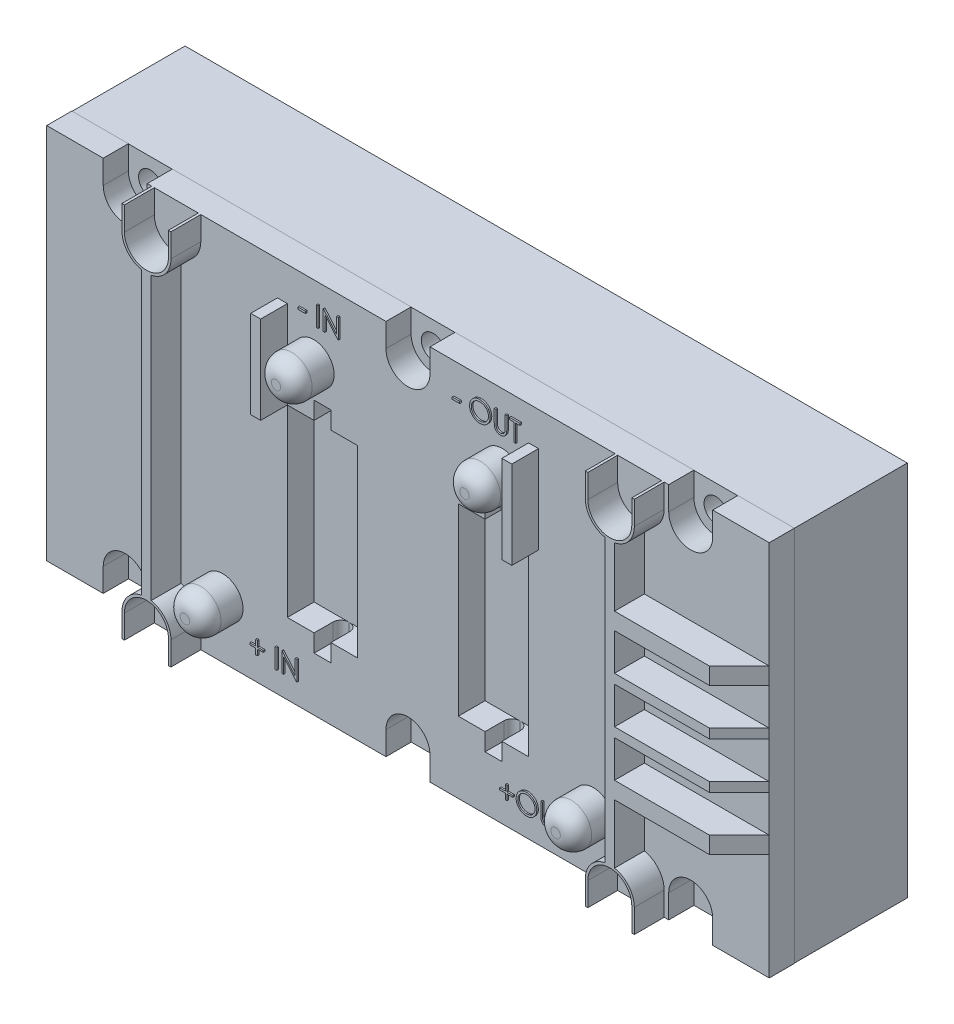
from build123d import *

# Parameters (mm, degrees)
SKETCH1_W            = 116.84
SKETCH1_H            = 60.96
BOSS_EXTRUDE1_DEPTH  = 27.178
CUT_EXTRUDE1_DEPTH   = 72.278120654
LPATTERN1_COUNT      = 3
LPATTERN1_PITCH      = 45.72
MIRROR1_COPY_1_DEPTH = 72.278120654
MIRROR1_COPY_2_DEPTH = 72.278120654
CUT_EXTRUDE2_DEPTH   = 8.89
LPATTERN2_COUNT      = 3
LPATTERN2_PITCH      = 45.72
MIRROR2_COPY_1_DEPTH = 8.89
MIRROR2_COPY_2_DEPTH = 8.89
CUT_EXTRUDE3_DEPTH   = 4.826
SKETCH5_W            = 20.193
SKETCH5_H            = 26.416
BOSS_EXTRUDE2_DEPTH  = 4.826
CHAMFER1_SIZE        = 4.826
SKETCH6_W            = 20.193
SKETCH6_H            = 5.969
CUT_EXTRUDE4_DEPTH   = 4.826
SKETCH7_R            = 3.302
BOSS_EXTRUDE3_DEPTH  = 6.096
FILLET1_R            = 2.54
SKETCH8_W            = 11.357334763
SKETCH8_H            = 29.751279107
CUT_EXTRUDE5_DEPTH   = 4.318
SKETCH9_W            = 1.604840782
SKETCH9_H            = 14.196668453
BOSS_EXTRUDE4_DEPTH  = 4.318
SKETCH10_W           = 2.715884399
SKETCH10_H           = 35.429946488
CUT_EXTRUDE6_DEPTH   = 4.318
FILLET2_R            = 1.27
FILLET2_OF_MIRROR4_R = 1.27
SKETCH11_W           = 1.221153846
SKETCH11_H           = 0.325641025
SKETCH11_W_2         = 0.284935898
SKETCH11_H_2         = 3.175
BOSS_EXTRUDE5_DEPTH  = 0.254
SKETCH12_W           = 1.221153846
SKETCH12_H           = 0.325641026
BOSS_EXTRUDE6_DEPTH  = 0.254
SKETCH13_W           = 0.284935897
SKETCH13_H           = 3.175
BOSS_EXTRUDE7_DEPTH  = 0.254
BOSS_EXTRUDE8_DEPTH  = 0.254
SKETCH15_W           = 116.84
SKETCH15_H           = 60.96
SKETCH15_W_2         = 116.7892
SKETCH15_H_2         = 60.9092
CUT_EXTRUDE7_DEPTH   = 18.288


with BuildPart() as part:
    # Sketch1 → Boss-Extrude1 (new body)
    with BuildSketch(Plane.XY):
        Rectangle(SKETCH1_W, SKETCH1_H)
    extrude(amount=BOSS_EXTRUDE1_DEPTH)

    # Sketch2 → Cut-Extrude1 (cut, through all)
    with BuildSketch(Plane.XY.offset(27.178)):
        with BuildLine():
            ThreePointArc((-47.625, 26.67), (-45.72, 24.765), (-43.815, 26.67))
            ThreePointArc((-43.815, 26.67), (-45.72, 28.575), (-47.625, 26.67))
        make_face()
    cut_extrude1 = extrude(amount=-CUT_EXTRUDE1_DEPTH, mode=Mode.SUBTRACT)

    # LPattern1: Cut-Extrude1 ×3
    with Locations(*[(i * LPATTERN1_PITCH, 0, 0) for i in range(1, LPATTERN1_COUNT)]):
        add(cut_extrude1, mode=Mode.SUBTRACT)

    # Mirror1: Cut-Extrude1 across plane
    add(cut_extrude1.mirror(Plane.ZX), mode=Mode.SUBTRACT)

    # Mirror1 copy 1 sketch → Mirror1 copy 1 (cut, through all)
    with BuildSketch(Plane(origin=(45.72, 0, 27.178), x_dir=(1, 0, 0), z_dir=(0, 0, 1))):
        with BuildLine():
            ThreePointArc((-47.625, -26.67), (-45.72, -24.765), (-43.815, -26.67))
            ThreePointArc((-43.815, -26.67), (-45.72, -28.575), (-47.625, -26.67))
        make_face()
    extrude(amount=-MIRROR1_COPY_1_DEPTH, mode=Mode.SUBTRACT)

    # Mirror1 copy 2 sketch → Mirror1 copy 2 (cut, through all)
    with BuildSketch(Plane(origin=(91.44, 0, 27.178), x_dir=(1, 0, 0), z_dir=(0, 0, 1))):
        with BuildLine():
            ThreePointArc((-47.625, -26.67), (-45.72, -24.765), (-43.815, -26.67))
            ThreePointArc((-43.815, -26.67), (-45.72, -28.575), (-47.625, -26.67))
        make_face()
    extrude(amount=-MIRROR1_COPY_2_DEPTH, mode=Mode.SUBTRACT)

    # Sketch3 → Cut-Extrude2 (cut)
    with BuildSketch(Plane.XY.offset(27.178)):
        with BuildLine():
            Line((-49.276, -26.67), (-49.276, -30.48))
            Line((-49.276, -30.48), (-42.164, -30.48))
            Line((-42.164, -30.48), (-42.164, -26.67))
            ThreePointArc((-42.164, -26.67), (-45.72, -23.114), (-49.276, -26.67))
        make_face()
    cut_extrude2 = extrude(amount=-CUT_EXTRUDE2_DEPTH, mode=Mode.SUBTRACT)

    # LPattern2: Cut-Extrude2 ×3
    with Locations(*[(i * LPATTERN2_PITCH, 0, 0) for i in range(1, LPATTERN2_COUNT)]):
        add(cut_extrude2, mode=Mode.SUBTRACT)

    # Mirror2: Cut-Extrude2 across plane
    add(cut_extrude2.mirror(Plane.ZX), mode=Mode.SUBTRACT)

    # Mirror2 copy 1 sketch → Mirror2 copy 1 (cut)
    with BuildSketch(Plane(origin=(45.72, 0, 27.178), x_dir=(1, 0, 0), z_dir=(0, 0, 1))):
        with BuildLine():
            Line((-49.276, 26.67), (-49.276, 30.48))
            Line((-49.276, 30.48), (-42.164, 30.48))
            Line((-42.164, 30.48), (-42.164, 26.67))
            ThreePointArc((-42.164, 26.67), (-45.72, 23.114), (-49.276, 26.67))
        make_face()
    extrude(amount=-MIRROR2_COPY_1_DEPTH, mode=Mode.SUBTRACT)

    # Mirror2 copy 2 sketch → Mirror2 copy 2 (cut)
    with BuildSketch(Plane(origin=(91.44, 0, 27.178), x_dir=(1, 0, 0), z_dir=(0, 0, 1))):
        with BuildLine():
            Line((-49.276, 26.67), (-49.276, 30.48))
            Line((-49.276, 30.48), (-42.164, 30.48))
            Line((-42.164, 30.48), (-42.164, 26.67))
            ThreePointArc((-42.164, 26.67), (-45.72, 23.114), (-49.276, 26.67))
        make_face()
    extrude(amount=-MIRROR2_COPY_2_DEPTH, mode=Mode.SUBTRACT)

    # Sketch4 → Cut-Extrude3 (cut)
    with BuildSketch(Plane.XY.offset(27.178)):
        with BuildLine():
            Line((-41.429134138, 26.67), (-41.429134138, 30.48))
            Line((-41.429134138, 30.48), (-42.164, 30.48))
            Line((-42.164, 30.48), (-42.164, 26.67))
            ThreePointArc((-42.164, 26.67), (-45.72, 23.114), (-49.276, 26.67))
            Line((-49.276, 26.67), (-49.276, 30.48))
            Line((-49.276, 30.48), (-58.42, 30.48))
            Line((-58.42, 30.48), (-58.42, -30.48))
            Line((-58.42, -30.48), (-49.276, -30.48))
            Line((-49.276, -30.48), (-49.276, -26.67))
            ThreePointArc((-49.276, -26.67), (-45.72, -23.114), (-42.164, -26.67))
            Line((-42.164, -26.67), (-42.164, -30.48))
            Line((-42.164, -30.48), (-41.429134138, -30.48))
            Line((-41.429134138, -30.48), (-41.429134138, -26.67))
            ThreePointArc((-41.429134138, -26.67), (-40.525639613, -24.15070553), (-38.227, -22.779792362))
            Line((-38.227, -22.779792362), (-38.227, 22.779792362))
            ThreePointArc((-38.227, 22.779792362), (-40.525639613, 24.15070553), (-41.429134138, 26.67))
        make_face()
        with BuildLine():
            Line((-3.556, 30.48), (-33.500865862, 30.48))
            Line((-33.500865862, 30.48), (-33.500865862, 26.67))
            ThreePointArc((-33.500865862, 26.67), (-34.404360387, 24.15070553), (-36.703, 22.779792362))
            Line((-36.703, 22.779792362), (-36.703, -22.779792362))
            ThreePointArc((-36.703, -22.779792362), (-34.404360387, -24.15070553), (-33.500865862, -26.67))
            Line((-33.500865862, -26.67), (-33.500865862, -30.48))
            Line((-33.500865862, -30.48), (-3.556, -30.48))
            Line((-3.556, -30.48), (-3.556, -26.67))
            ThreePointArc((-3.556, -26.67), (-2.514471714, -24.155528286), (0, -23.114))
            Line((0, -23.114), (0, 23.114))
            ThreePointArc((0, 23.114), (-2.514471714, 24.155528286), (-3.556, 26.67))
            Line((-3.556, 26.67), (-3.556, 30.48))
        make_face()
        with BuildLine():
            Line((-41.021, -26.67), (-41.021, -30.48))
            Line((-41.021, -30.48), (-33.909, -30.48))
            Line((-33.909, -30.48), (-33.909, -26.67))
            ThreePointArc((-33.909, -26.67), (-37.465, -23.114), (-41.021, -26.67))
        make_face()
        with BuildLine():
            Line((-41.021, 30.48), (-41.021, 26.67))
            ThreePointArc((-41.021, 26.67), (-37.465, 23.114), (-33.909, 26.67))
            Line((-33.909, 26.67), (-33.909, 30.48))
            Line((-33.909, 30.48), (-41.021, 30.48))
        make_face()
    cut_extrude3 = extrude(amount=-CUT_EXTRUDE3_DEPTH, mode=Mode.SUBTRACT)

    # Mirror3: Cut-Extrude3 across plane
    add(cut_extrude3.mirror(Plane(origin=(0, 0, 0), x_dir=(0, 0, 1), z_dir=(1, 0, 0))), mode=Mode.SUBTRACT)

    # Sketch5 → Boss-Extrude2 (add)
    with BuildSketch(Plane.XY.offset(22.352)):
        with Locations((48.3235, 0)):
            Rectangle(SKETCH5_W, SKETCH5_H)
    extrude(amount=BOSS_EXTRUDE2_DEPTH)

    # Chamfer1
    chamfer1_edges = [part.edges().sort_by_distance(p)[0] for p in [
        (58.42, 0, 27.178),
    ]]
    chamfer(chamfer1_edges, length=CHAMFER1_SIZE)

    # Sketch6 → Cut-Extrude4 (cut)
    with BuildSketch(Plane.XY.offset(27.178)):
        with Locations((48.3235, 7.493)):
            Rectangle(SKETCH6_W, SKETCH6_H)
        with Locations((48.3235, 0)):
            Rectangle(SKETCH6_W, SKETCH6_H)
        with Locations((48.3235, -7.493)):
            Rectangle(SKETCH6_W, SKETCH6_H)
    extrude(amount=-CUT_EXTRUDE4_DEPTH, mode=Mode.SUBTRACT)

    # Sketch7 → Boss-Extrude3 (add)
    with BuildSketch(Plane.XY.offset(22.352)):
        with Locations(Location((-15.24, 18.796, 0), (0, 0, 180))):
            Circle(SKETCH7_R)
        with Locations(Location((15.24, 18.796, 0), (0, 0, 180))):
            Circle(SKETCH7_R)
        with Locations(Location((29.972, -21.336, 0), (0, 0, 180))):
            Circle(SKETCH7_R)
        with Locations(Location((-29.972, -21.336, 0), (0, 0, 180))):
            Circle(SKETCH7_R)
    extrude(amount=BOSS_EXTRUDE3_DEPTH)

    # Fillet1
    fillet1_edges = [part.edges().sort_by_distance(p)[0] for p in [
        (-11.938, 18.796, 28.448),
        (18.542, 18.796, 28.448),
        (33.274, -21.336, 28.448),
        (-26.67, -21.336, 28.448),
    ]]
    fillet(fillet1_edges, radius=FILLET1_R)

    # Sketch8 → Cut-Extrude5 (cut)
    with BuildSketch(Plane.XY.offset(22.352)):
        with Locations((-13.826320581, -4.073826599)):
            Rectangle(SKETCH8_W, SKETCH8_H)
    cut_extrude5 = extrude(amount=-CUT_EXTRUDE5_DEPTH, mode=Mode.SUBTRACT)

    # Sketch9 → Boss-Extrude4 (add)
    with BuildSketch(Plane.XY.offset(22.352)):
        with Locations((-20.307408353, 17.90014718)):
            Rectangle(SKETCH9_W, SKETCH9_H)
    boss_extrude4 = extrude(amount=BOSS_EXTRUDE4_DEPTH)

    # Sketch10 → Cut-Extrude6 (cut)
    with BuildSketch(Plane.XY.offset(22.352)):
        with Locations((-13.826320581, -4.0738266)):
            Rectangle(SKETCH10_W, SKETCH10_H)
    cut_extrude6 = extrude(amount=-CUT_EXTRUDE6_DEPTH, mode=Mode.SUBTRACT)

    # Fillet2
    fillet2_edges = [part.edges().sort_by_distance(p)[0] for p in [
        (-15.18426278, 12.221479799, 18.034),
        (-12.468378381, 12.221479799, 18.034),
        (-12.468378381, -20.369132998, 18.034),
        (-15.18426278, -20.369132998, 18.034),
    ]]
    fillet(fillet2_edges, radius=FILLET2_R)

    # Mirror4: Cut-Extrude5, Boss-Extrude4, Cut-Extrude6 across plane
    add(cut_extrude5.mirror(Plane(origin=(0, 0, 0), x_dir=(0, 0, 1), z_dir=(1, 0, 0))), mode=Mode.SUBTRACT)
    add(boss_extrude4.mirror(Plane(origin=(0, 0, 0), x_dir=(0, 0, 1), z_dir=(1, 0, 0))))
    add(cut_extrude6.mirror(Plane(origin=(0, 0, 0), x_dir=(0, 0, 1), z_dir=(1, 0, 0))), mode=Mode.SUBTRACT)

    # Fillet2 of Mirror4
    fillet2_of_mirror4_edges = [part.edges().sort_by_distance(p)[0] for p in [
        (15.18426278, 12.221479799, 18.034),
        (12.468378381, 12.221479799, 18.034),
        (12.468378381, -20.369132998, 18.034),
        (15.18426278, -20.369132998, 18.034),
    ]]
    fillet(fillet2_of_mirror4_edges, radius=FILLET2_OF_MIRROR4_R)

    # Sketch11 → Boss-Extrude5 (add)
    with BuildSketch(Plane.XY.offset(22.352)):
        with Locations((-16.920556291, 25.478939508)):
            Rectangle(SKETCH11_W, SKETCH11_H)
        with Locations((-14.417190906, 25.845285661)):
            Rectangle(SKETCH11_W_2, SKETCH11_H_2)
        Polygon((-13.460620393, 24.257785661), (-13.460620393, 27.432785661), (-13.400834736, 27.432785661), (-11.303248598, 24.9338724), (-11.303248598, 27.432785661), (-11.018312701, 27.432785661), (-11.018312701, 24.257785661), (-11.083186499, 24.257785661), (-13.175684496, 26.750974764), (-13.175684496, 24.257785661), align=None)
    extrude(amount=BOSS_EXTRUDE5_DEPTH)

    # Sketch12 → Boss-Extrude6 (add)
    # profile 1 of 4: a face of its own
    with BuildSketch(Plane.XY.offset(22.352)):
        with Locations((8.016200471, 25.355490217)):
            Rectangle(SKETCH12_W, SKETCH12_H)
    # profile 2 of 4: a face of its own
    with BuildSketch(Plane.XY.offset(22.352)):
        with BuildLine():
            add(Edge.make_bspline(
                [(11.862835086, 27.390746627), (11.921625296, 27.389257571), (12.03709412, 27.386332941), (12.206797777, 27.363945469), (12.368809042, 27.325214651), (12.524447668, 27.273631802), (12.671852011, 27.204821038), (12.812131578, 27.121649511), (12.944952599, 27.023245866), (13.068524852, 26.910370782), (13.181606514, 26.787558649), (13.281234283, 26.656496545), (13.364729792, 26.517976917), (13.433296899, 26.37241602), (13.487089209, 26.22014305), (13.524208627, 26.060346204), (13.547919664, 25.89406085), (13.55069169, 25.780643622), (13.552097907, 25.723108406)],
                knots=[0, 0, 0, 0, 1.065120563, 2.091984664, 3.0946048, 4.079830382, 5.057816894, 6.036188127, 7.030412546, 8.04752943, 9.064399622, 10.05169764, 11.02544977, 11.989514704, 12.962713494, 13.945757189, 14.957906945, 16, 16, 16, 16], degree=3))
            add(Edge.make_bspline(
                [(13.552097907, 25.723108406), (13.550691896, 25.665997008), (13.547920487, 25.553423827), (13.524181668, 25.388193702), (13.486951618, 25.229361428), (13.433796433, 25.077192157), (13.365556178, 24.931525367), (13.281504701, 24.792744344), (13.182498032, 24.660803592), (13.069824674, 24.537148532), (12.946996586, 24.423757969), (12.815251987, 24.324952989), (12.677553761, 24.239931819), (12.532129954, 24.172092343), (12.380909206, 24.117870672), (12.222538099, 24.080902215), (12.057758725, 24.057056112), (11.945390029, 24.054317887), (11.888275791, 24.052926114)],
                knots=[0, 0, 0, 0, 1.043624062, 2.057103931, 3.04512605, 4.022047818, 4.998200453, 5.980619268, 6.982898556, 8.009068085, 9.034988726, 10.034168286, 11.015286542, 11.987931943, 12.962482838, 13.94673481, 14.956375938, 16, 16, 16, 16], degree=3))
            add(Edge.make_bspline(
                [(11.888275791, 24.052926114), (11.830740873, 24.054331629), (11.717324235, 24.057102274), (11.550829924, 24.080852548), (11.390920828, 24.11799216), (11.238054238, 24.171068577), (11.092144909, 24.239664208), (10.952907476, 24.323306751), (10.820900821, 24.422554658), (10.69721938, 24.535191479), (10.584054036, 24.657811387), (10.485393745, 24.789196747), (10.401732392, 24.926769911), (10.333367084, 25.070912665), (10.279242895, 25.220928188), (10.24231781, 25.377817164), (10.21842734, 25.540685145), (10.2156743, 25.651576917), (10.214277394, 25.707843983)],
                knots=[0, 0, 0, 0, 1.053102029, 2.075944431, 3.073151272, 4.055350789, 5.033113405, 6.020478099, 7.024410459, 8.052272461, 9.079885166, 10.07527673, 11.055994387, 12.023226415, 12.992069828, 13.970394897, 14.97016774, 16, 16, 16, 16], degree=3))
            add(Edge.make_bspline(
                [(10.214277394, 25.707843983), (10.214762385, 25.745610761), (10.215726248, 25.820667873), (10.22733014, 25.932125432), (10.244168255, 26.041790529), (10.26829999, 26.149351317), (10.299861002, 26.254544496), (10.337101055, 26.358095545), (10.382585058, 26.458955066), (10.434002503, 26.557600857), (10.49139, 26.652495172), (10.554777287, 26.742193079), (10.621937943, 26.827447269), (10.695564736, 26.90604848), (10.773231082, 26.980283297), (10.856196897, 27.049010904), (10.943955933, 27.112851038), (11.036885806, 27.170382348), (11.13269667, 27.222415277), (11.231463461, 27.267066528), (11.331844779, 27.305389741), (11.434310781, 27.336451061), (11.538589367, 27.360972979), (11.644908129, 27.377671078), (11.753182366, 27.389304567), (11.826126919, 27.390263872), (11.862835086, 27.390746627)],
                knots=[0, 0, 0, 0, 1.037015668, 2.060948919, 3.074880161, 4.083647147, 5.086022904, 6.090072063, 7.104153813, 8.122640571, 9.144368836, 10.147691507, 11.138137339, 12.123020368, 13.103399296, 14.087645067, 15.080126199, 16.082011238, 17.087798457, 18.072939717, 19.057185487, 20.037253025, 21.01195951, 21.997135196, 22.992090687, 24, 24, 24, 24], degree=3))
        make_face()
        with BuildLine():
            add(Edge.make_bspline(
                [(11.876827474, 27.065105601), (11.846697056, 27.064738308), (11.78672427, 27.064007233), (11.697566155, 27.054377262), (11.609580615, 27.040652292), (11.522749479, 27.021074769), (11.43743606, 26.994401093), (11.352845132, 26.963702555), (11.269748076, 26.926309137), (11.18841922, 26.884061041), (11.10957483, 26.837298805), (11.035177594, 26.785617274), (10.965034909, 26.730228442), (10.899318518, 26.671003047), (10.838221383, 26.60763948), (10.780540975, 26.541098341), (10.728589283, 26.469477697), (10.680977367, 26.394719685), (10.638370826, 26.316921679), (10.600483683, 26.236902733), (10.569492046, 26.154010117), (10.544216891, 26.069143131), (10.523262062, 25.982436186), (10.509987003, 25.893231523), (10.500251219, 25.801977386), (10.499561931, 25.740308132), (10.499213291, 25.709116018)],
                knots=[0, 0, 0, 0, 1.008559885, 2.007477868, 2.99961109, 3.989939068, 4.984837346, 5.991145699, 7.001802488, 8.033829008, 9.059044045, 10.069351652, 11.065060232, 12.050310815, 13.029377138, 14.011219647, 14.996725999, 15.989392538, 16.977580475, 17.965360261, 18.951710183, 19.937753436, 20.929683414, 21.935841486, 22.955955122, 24, 24, 24, 24], degree=3))
            add(Edge.make_bspline(
                [(10.499213291, 25.709116018), (10.500369773, 25.663248861), (10.502644931, 25.573013972), (10.522563584, 25.440781442), (10.553244946, 25.313701354), (10.5984727, 25.19246905), (10.655033615, 25.076042451), (10.724908008, 24.965454384), (10.807693036, 24.860674963), (10.901730663, 24.762435683), (11.004530547, 24.672768418), (11.113689524, 24.594061611), (11.228038153, 24.527468027), (11.34787463, 24.473216283), (11.472559183, 24.430227021), (11.602895248, 24.400764263), (11.738014593, 24.381373671), (11.830117402, 24.379511528), (11.876827474, 24.37856714)],
                knots=[0, 0, 0, 0, 1.032063989, 2.030389145, 3.003944642, 3.970395727, 4.937377036, 5.913328081, 6.909231446, 7.93887556, 8.970685674, 9.976071282, 10.964166581, 11.944589148, 12.933237628, 13.927779006, 14.949070134, 16, 16, 16, 16], degree=3))
            add(Edge.make_bspline(
                [(11.876827474, 24.37856714), (11.908223236, 24.37899849), (11.970490462, 24.379853988), (12.063105686, 24.388470644), (12.154052392, 24.402288126), (12.243203017, 24.422182364), (12.330456382, 24.447080901), (12.416176668, 24.476660768), (12.499450831, 24.513564432), (12.581329398, 24.554338645), (12.659703132, 24.600820788), (12.734520222, 24.650748252), (12.803894861, 24.706055501), (12.86956209, 24.764400945), (12.930910065, 24.826961007), (12.987523929, 24.893654351), (13.039213049, 24.964901947), (13.086806885, 25.039546566), (13.129264131, 25.117557452), (13.166256599, 25.197866517), (13.197640219, 25.280276009), (13.222975362, 25.364904792), (13.242828603, 25.451592133), (13.256508244, 25.540454104), (13.266077185, 25.631312936), (13.266798434, 25.692766291), (13.267162009, 25.723744423)],
                knots=[0, 0, 0, 0, 1.047197238, 2.076906641, 3.100256066, 4.114471768, 5.12198147, 6.126382909, 7.136867548, 8.15857795, 9.17633901, 10.174870724, 11.156907918, 12.133735059, 13.104061851, 14.077631395, 15.04955518, 16.038496417, 17.029181396, 18.010275684, 18.986308667, 19.968651475, 20.955262928, 21.950658345, 22.966943676, 24, 24, 24, 24], degree=3))
            add(Edge.make_bspline(
                [(13.267162009, 25.723744423), (13.266798142, 25.754510631), (13.266076346, 25.815541071), (13.256512815, 25.905766242), (13.24281415, 25.993988798), (13.223072265, 26.07986239), (13.197626768, 26.16340891), (13.166251119, 26.244549888), (13.129253026, 26.323587608), (13.086791279, 26.40032672), (13.039061211, 26.473963804), (12.986905719, 26.544360278), (12.929424296, 26.610194122), (12.868259259, 26.673090594), (12.801882813, 26.731708251), (12.730595632, 26.786066538), (12.655263153, 26.837477294), (12.575500589, 26.883855482), (12.49318286, 26.926685536), (12.408715198, 26.963380375), (12.323054515, 26.994560797), (12.236418641, 27.021155473), (12.148078368, 27.040575614), (12.058630609, 27.054389631), (11.968199117, 27.064003881), (11.907381339, 27.064737196), (11.876827474, 27.065105601)],
                knots=[0, 0, 0, 0, 1.02996197, 2.043119294, 3.035359645, 4.018872909, 4.991431989, 5.957985074, 6.929999688, 7.912076566, 8.892894881, 9.867085534, 10.843653904, 11.817741046, 12.803660682, 13.806313499, 14.818574707, 15.856120519, 16.894564902, 17.924820532, 18.937903209, 19.946497019, 20.957711757, 21.963978472, 22.977135795, 24, 24, 24, 24], degree=3))
        make_face(mode=Mode.SUBTRACT)
    # profile 3 of 4: a face of its own
    with BuildSketch(Plane.XY.offset(22.352)):
        with BuildLine():
            Line((14.203379958, 27.309336371), (14.488315855, 27.309336371))
            Line((14.488315855, 27.309336371), (14.488315855, 25.407007645))
            add(Edge.make_bspline(
                [(14.488315855, 25.407007645), (14.488273452, 25.380082977), (14.488192984, 25.328988781), (14.488730479, 25.25626468), (14.490235763, 25.191610378), (14.491184779, 25.134776655), (14.493296003, 25.086024306), (14.495017803, 25.045089202), (14.497231736, 25.012165176), (14.499892493, 24.99295105), (14.501036208, 24.984691939)],
                knots=[0, 0, 0, 0, 1.528628734, 2.90083645, 4.128790002, 5.200304208, 6.127813768, 6.898992206, 7.526736466, 8, 8, 8, 8], degree=3))
            add(Edge.make_bspline(
                [(14.501036208, 24.984691939), (14.505732903, 24.954895233), (14.51486165, 24.896980757), (14.538126579, 24.814513958), (14.570618169, 24.740190421), (14.609120072, 24.671690893), (14.659858941, 24.610921974), (14.720640719, 24.554940688), (14.794280552, 24.505980551), (14.876159816, 24.461212315), (14.964411424, 24.425230419), (15.054591644, 24.398022153), (15.145344918, 24.381440579), (15.206101868, 24.379520576), (15.236272586, 24.37856714)],
                knots=[0, 0, 0, 0, 1.035780045, 2.013197591, 2.933192213, 3.817615948, 4.702609284, 5.640816605, 6.646850145, 7.73207398, 8.84249596, 9.914020372, 10.964143139, 12, 12, 12, 12], degree=3))
            add(Edge.make_bspline(
                [(15.236272586, 24.37856714), (15.262174908, 24.379541275), (15.313829946, 24.38148392), (15.390580065, 24.393513933), (15.465328735, 24.41519516), (15.538445066, 24.443171227), (15.606980602, 24.480135113), (15.670973582, 24.522835089), (15.728090865, 24.572919241), (15.780213477, 24.628345982), (15.825602312, 24.690884229), (15.864946133, 24.759172254), (15.897173227, 24.834237733), (15.91308771, 24.886992102), (15.921263572, 24.914093983)],
                knots=[0, 0, 0, 0, 0.994687771, 1.983630487, 2.973142513, 3.978332533, 4.983357753, 5.956394766, 6.925816176, 7.893390482, 8.871859704, 9.88551698, 10.913711441, 12, 12, 12, 12], degree=3))
            add(Edge.make_bspline(
                [(15.921263572, 24.914093983), (15.923985114, 24.925295904), (15.930049807, 24.950258298), (15.935716769, 24.992459755), (15.941619117, 25.042252249), (15.945714477, 25.099993536), (15.949707013, 25.165490133), (15.952095586, 25.239083238), (15.953199609, 25.320505624), (15.953528611, 25.377326478), (15.953700471, 25.407007645)],
                knots=[0, 0, 0, 0, 0.558680831, 1.244966039, 2.062412453, 2.990489873, 4.051219941, 5.244515665, 6.560634259, 8, 8, 8, 8], degree=3))
            Line((15.953700471, 25.407007645), (15.953700471, 27.309336371))
            Line((15.953700471, 27.309336371), (16.238636368, 27.309336371))
            Line((16.238636368, 27.309336371), (16.238636368, 25.391743222))
            add(Edge.make_bspline(
                [(16.238636368, 25.391743222), (16.238405845, 25.357182549), (16.237955964, 25.289735296), (16.234054727, 25.190900849), (16.227834448, 25.09714493), (16.219045969, 25.008454937), (16.207400973, 24.925148235), (16.194451308, 24.846494624), (16.177959875, 24.773058695), (16.158698147, 24.704267859), (16.136678571, 24.638785286), (16.108156958, 24.576638186), (16.076021876, 24.515937266), (16.037908583, 24.457600624), (15.995081115, 24.401369965), (15.946592805, 24.347586304), (15.894047316, 24.29539017), (15.836571144, 24.24612046), (15.775111739, 24.200936874), (15.70985192, 24.161206039), (15.641292993, 24.127620329), (15.569613172, 24.099974312), (15.494781866, 24.079187497), (15.41679719, 24.063697891), (15.335481636, 24.054896521), (15.280177983, 24.053588485), (15.252173027, 24.052926114)],
                knots=[0, 0, 0, 0, 1.316592851, 2.569410997, 3.76748051, 4.895814652, 5.963796859, 6.97159953, 7.931736103, 8.829262218, 9.692595152, 10.560224239, 11.431080259, 12.30701507, 13.211635791, 14.121146779, 15.063487852, 16.031507147, 17.00238618, 17.966455255, 18.938106653, 19.907068911, 20.888905087, 21.893141452, 22.933117798, 24, 24, 24, 24], degree=3))
            add(Edge.make_bspline(
                [(15.252173027, 24.052926114), (15.221630341, 24.053638008), (15.1617057, 24.055034742), (15.073406168, 24.063038237), (14.988756861, 24.078113495), (14.906863744, 24.097308587), (14.82884175, 24.123782405), (14.753645554, 24.154714276), (14.682563036, 24.192702933), (14.614441027, 24.234969797), (14.551099998, 24.282526433), (14.492954497, 24.334360734), (14.439908528, 24.389642362), (14.392856211, 24.448969836), (14.35101798, 24.511881742), (14.314977001, 24.578556052), (14.284031415, 24.648966954), (14.268059743, 24.697910214), (14.259985527, 24.722652677)],
                knots=[0, 0, 0, 0, 1.13879206, 2.234305948, 3.301075583, 4.341971843, 5.366689343, 6.369221514, 7.369726634, 8.367512178, 9.355451585, 10.318319045, 11.268648973, 12.207971039, 13.137398894, 14.081662264, 15.030215811, 16, 16, 16, 16], degree=3))
            add(Edge.make_bspline(
                [(14.259985527, 24.722652677), (14.255289105, 24.739555083), (14.245102461, 24.77621678), (14.234193798, 24.836892381), (14.225023417, 24.906755913), (14.216400517, 24.98581216), (14.211312391, 25.074122396), (14.206851572, 25.171648341), (14.203348532, 25.278507921), (14.20336919, 25.352943088), (14.203379958, 25.391743222)],
                knots=[0, 0, 0, 0, 0.625038921, 1.35572334, 2.194682327, 3.136881307, 4.189498639, 5.346923369, 6.617055217, 8, 8, 8, 8], degree=3))
            Line((14.203379958, 25.391743222), (14.203379958, 27.309336371))
        make_face()
    # profile 4 of 4: a face of its own
    with BuildSketch(Plane.XY.offset(22.352)):
        Polygon((16.686392778, 26.983695345), (16.686392778, 27.309336371), (18.355303035, 27.309336371), (18.355303035, 26.983695345), (17.663315855, 26.983695345), (17.663315855, 24.134336371), (17.378379958, 24.134336371), (17.378379958, 26.983695345), align=None)
    extrude(amount=BOSS_EXTRUDE6_DEPTH)

    # Sketch13 → Boss-Extrude7 (add)
    with BuildSketch(Plane.XY.offset(22.352)):
        Polygon((-24.373554498, -25.264054677), (-24.373554498, -24.327836728), (-24.088618601, -24.327836728), (-24.088618601, -25.264054677), (-23.152400652, -25.264054677), (-23.152400652, -25.548990574), (-24.088618601, -25.548990574), (-24.088618601, -26.485208523), (-24.373554498, -26.485208523), (-24.373554498, -25.548990574), (-25.309772447, -25.548990574), (-25.309772447, -25.264054677), align=None)
        with Locations((-21.096791678, -25.386170061)):
            Rectangle(SKETCH13_W, SKETCH13_H)
        Polygon((-20.140221165, -26.973670061), (-20.140221165, -23.798670061), (-20.080435508, -23.798670061), (-17.98284937, -26.297583322), (-17.98284937, -23.798670061), (-17.697913472, -23.798670061), (-17.697913472, -26.973670061), (-17.76278727, -26.973670061), (-19.855285267, -24.480480959), (-19.855285267, -26.973670061), align=None)
    extrude(amount=BOSS_EXTRUDE7_DEPTH)

    # Sketch14 → Boss-Extrude8 (add)
    # profile 1 of 4: a face of its own
    with BuildSketch(Plane.XY.offset(22.352)):
        Polygon((15.994363626, -25.387503968), (15.994363626, -24.451286019), (16.279299523, -24.451286019), (16.279299523, -25.387503968), (17.215517472, -25.387503968), (17.215517472, -25.672439865), (16.279299523, -25.672439865), (16.279299523, -26.608657814), (15.994363626, -26.608657814), (15.994363626, -25.672439865), (15.058145677, -25.672439865), (15.058145677, -25.387503968), align=None)
    # profile 2 of 4: a face of its own
    with BuildSketch(Plane.XY.offset(22.352)):
        with BuildLine():
            add(Edge.make_bspline(
                [(19.393241831, -23.840709096), (19.452032041, -23.842198152), (19.567500865, -23.845122781), (19.737204522, -23.867510254), (19.899215787, -23.906241072), (20.054854413, -23.95782392), (20.202258756, -24.026634684), (20.342538323, -24.109806212), (20.475359344, -24.208209856), (20.598931597, -24.321084941), (20.712013259, -24.443897074), (20.811641028, -24.574959178), (20.895136537, -24.713478806), (20.963703644, -24.859039702), (21.017495954, -25.011312673), (21.054615372, -25.171109519), (21.078326408, -25.337394873), (21.081098435, -25.4508121), (21.082504651, -25.508347317)],
                knots=[0, 0, 0, 0, 1.065120563, 2.091984664, 3.0946048, 4.079830382, 5.057816894, 6.036188127, 7.030412546, 8.04752943, 9.064399622, 10.05169764, 11.02544977, 11.989514704, 12.962713494, 13.945757189, 14.957906945, 16, 16, 16, 16], degree=3))
            add(Edge.make_bspline(
                [(21.082504651, -25.508347317), (21.081098641, -25.565458715), (21.078327232, -25.678031896), (21.054588412, -25.84326202), (21.017358363, -26.002094295), (20.964203178, -26.154263566), (20.895962923, -26.299930356), (20.811911446, -26.438711378), (20.712904776, -26.57065213), (20.600231419, -26.694307191), (20.47740333, -26.807697754), (20.345658731, -26.906502734), (20.207960505, -26.991523904), (20.062536699, -27.05936338), (19.911315951, -27.11358505), (19.752944844, -27.150553507), (19.58816547, -27.174399611), (19.475796773, -27.177137836), (19.418682536, -27.178529609)],
                knots=[0, 0, 0, 0, 1.043624062, 2.057103931, 3.04512605, 4.022047818, 4.998200453, 5.980619268, 6.982898556, 8.009068085, 9.034988726, 10.034168286, 11.015286542, 11.987931943, 12.962482838, 13.94673481, 14.956375938, 16, 16, 16, 16], degree=3))
            add(Edge.make_bspline(
                [(19.418682536, -27.178529609), (19.361147618, -27.177124093), (19.247730979, -27.174353449), (19.081236669, -27.150603174), (18.921327572, -27.113463563), (18.768460982, -27.060387146), (18.622551653, -26.991791515), (18.483314221, -26.908148971), (18.351307566, -26.808901065), (18.227626125, -26.696264243), (18.114460781, -26.573644336), (18.01580049, -26.442258976), (17.932139137, -26.304685811), (17.863773828, -26.160543057), (17.80964964, -26.010527534), (17.772724555, -25.853638558), (17.748834084, -25.690770578), (17.746081045, -25.579878806), (17.744684139, -25.52361174)],
                knots=[0, 0, 0, 0, 1.053102029, 2.075944431, 3.073151272, 4.055350789, 5.033113405, 6.020478099, 7.024410459, 8.052272461, 9.079885166, 10.07527673, 11.055994387, 12.023226415, 12.992069828, 13.970394897, 14.97016774, 16, 16, 16, 16], degree=3))
            add(Edge.make_bspline(
                [(17.744684139, -25.52361174), (17.745169129, -25.485844962), (17.746132993, -25.410787849), (17.757736885, -25.299330291), (17.774575, -25.189665194), (17.798706735, -25.082104406), (17.830267747, -24.976911227), (17.8675078, -24.873360177), (17.912991803, -24.772500657), (17.964409248, -24.673854866), (18.021796745, -24.578960551), (18.085184032, -24.489262643), (18.152344688, -24.404008453), (18.225971481, -24.325407243), (18.303637827, -24.251172426), (18.386603642, -24.182444818), (18.474362678, -24.118604684), (18.567292551, -24.061073375), (18.663103414, -24.009040446), (18.761870206, -23.964389195), (18.862251524, -23.926065982), (18.964717526, -23.895004662), (19.068996112, -23.870482744), (19.175314874, -23.853784644), (19.283589111, -23.842151156), (19.356533664, -23.841191851), (19.393241831, -23.840709096)],
                knots=[0, 0, 0, 0, 1.037015668, 2.060948919, 3.074880161, 4.083647147, 5.086022904, 6.090072063, 7.104153813, 8.122640571, 9.144368836, 10.147691507, 11.138137339, 12.123020368, 13.103399296, 14.087645067, 15.080126199, 16.082011238, 17.087798457, 18.072939717, 19.057185487, 20.037253025, 21.01195951, 21.997135196, 22.992090687, 24, 24, 24, 24], degree=3))
        make_face()
        with BuildLine():
            add(Edge.make_bspline(
                [(19.407234219, -24.166350121), (19.377103801, -24.166717415), (19.317131015, -24.16744849), (19.2279729, -24.17707846), (19.13998736, -24.190803431), (19.053156224, -24.210380954), (18.967842804, -24.23705463), (18.883251877, -24.267753168), (18.800154821, -24.305146586), (18.718825964, -24.347394682), (18.639981575, -24.394156917), (18.565584338, -24.445838449), (18.495441654, -24.50122728), (18.429725262, -24.560452676), (18.368628128, -24.623816243), (18.31094772, -24.690357382), (18.258996028, -24.761978026), (18.211384112, -24.836736037), (18.168777571, -24.914534043), (18.130890428, -24.99455299), (18.099898791, -25.077445606), (18.074623636, -25.162312591), (18.053668807, -25.249019537), (18.040393747, -25.3382242), (18.030657964, -25.429478337), (18.029968676, -25.491147591), (18.029620036, -25.522339705)],
                knots=[0, 0, 0, 0, 1.008559885, 2.007477868, 2.99961109, 3.989939068, 4.984837346, 5.991145699, 7.001802488, 8.033829008, 9.059044045, 10.069351652, 11.065060232, 12.050310815, 13.029377138, 14.011219647, 14.996725999, 15.989392538, 16.977580475, 17.965360261, 18.951710183, 19.937753436, 20.929683414, 21.935841486, 22.955955122, 24, 24, 24, 24], degree=3))
            add(Edge.make_bspline(
                [(18.029620036, -25.522339705), (18.030776518, -25.568206862), (18.033051676, -25.65844175), (18.052970328, -25.790674281), (18.083651691, -25.917754369), (18.128879445, -26.038986673), (18.18544036, -26.155413272), (18.255314753, -26.266001338), (18.338099781, -26.37078076), (18.432137408, -26.46902004), (18.534937292, -26.558687305), (18.644096269, -26.637394112), (18.758444898, -26.703987695), (18.878281375, -26.75823944), (19.002965928, -26.801228702), (19.133301992, -26.83069146), (19.268421338, -26.850082052), (19.360524146, -26.851944194), (19.407234219, -26.852888583)],
                knots=[0, 0, 0, 0, 1.032063989, 2.030389145, 3.003944642, 3.970395727, 4.937377036, 5.913328081, 6.909231446, 7.93887556, 8.970685674, 9.976071282, 10.964166581, 11.944589148, 12.933237628, 13.927779006, 14.949070134, 16, 16, 16, 16], degree=3))
            add(Edge.make_bspline(
                [(19.407234219, -26.852888583), (19.438629981, -26.852457233), (19.500897207, -26.851601735), (19.593512431, -26.842985078), (19.684459137, -26.829167597), (19.773609762, -26.809273359), (19.860863127, -26.784374822), (19.946583413, -26.754794954), (20.029857576, -26.717891291), (20.111736143, -26.677117078), (20.190109877, -26.630634935), (20.264926967, -26.580707471), (20.334301605, -26.525400222), (20.399968835, -26.467054778), (20.46131681, -26.404494716), (20.517930674, -26.337801371), (20.569619794, -26.266553775), (20.61721363, -26.191909157), (20.659670876, -26.113898271), (20.696663344, -26.033589206), (20.728046964, -25.951179714), (20.753382107, -25.866550931), (20.773235347, -25.77986359), (20.786914989, -25.691001619), (20.79648393, -25.600142787), (20.797205178, -25.538689432), (20.797568754, -25.507711299)],
                knots=[0, 0, 0, 0, 1.047197238, 2.076906641, 3.100256066, 4.114471768, 5.12198147, 6.126382909, 7.136867548, 8.15857795, 9.17633901, 10.174870724, 11.156907918, 12.133735059, 13.104061851, 14.077631395, 15.04955518, 16.038496417, 17.029181396, 18.010275684, 18.986308667, 19.968651475, 20.955262928, 21.950658345, 22.966943676, 24, 24, 24, 24], degree=3))
            add(Edge.make_bspline(
                [(20.797568754, -25.507711299), (20.797204887, -25.476945092), (20.79648309, -25.415914652), (20.78691956, -25.325689481), (20.773220895, -25.237466925), (20.75347901, -25.151593332), (20.728033513, -25.068046813), (20.696657864, -24.986905835), (20.65965977, -24.907868115), (20.617198024, -24.831129003), (20.569467956, -24.757491919), (20.517312463, -24.687095445), (20.45983104, -24.621261601), (20.398666004, -24.558365128), (20.332289558, -24.499747471), (20.261002377, -24.445389185), (20.185669897, -24.393978429), (20.105907334, -24.347600241), (20.023589604, -24.304770187), (19.939121943, -24.268075348), (19.853461259, -24.236894925), (19.766825386, -24.21030025), (19.678485113, -24.190880108), (19.589037354, -24.177066092), (19.498605862, -24.167451842), (19.437788084, -24.166718527), (19.407234219, -24.166350121)],
                knots=[0, 0, 0, 0, 1.02996197, 2.043119294, 3.035359645, 4.018872909, 4.991431989, 5.957985074, 6.929999688, 7.912076566, 8.892894881, 9.867085534, 10.843653904, 11.817741046, 12.803660682, 13.806313499, 14.818574707, 15.856120519, 16.894564902, 17.924820532, 18.937903209, 19.946497019, 20.957711757, 21.963978472, 22.977135795, 24, 24, 24, 24], degree=3))
        make_face(mode=Mode.SUBTRACT)
    # profile 3 of 4: a face of its own
    with BuildSketch(Plane.XY.offset(22.352)):
        with BuildLine():
            Line((21.733786703, -23.922119352), (22.0187226, -23.922119352))
            Line((22.0187226, -23.922119352), (22.0187226, -25.824448078))
            add(Edge.make_bspline(
                [(22.0187226, -25.824448078), (22.018680197, -25.851372746), (22.018599729, -25.902466942), (22.019137223, -25.975191043), (22.020642508, -26.039845345), (22.021591524, -26.096679068), (22.023702748, -26.145431417), (22.025424548, -26.18636652), (22.027638481, -26.219290547), (22.030299238, -26.238504673), (22.031442953, -26.246763783)],
                knots=[0, 0, 0, 0, 1.528628734, 2.90083645, 4.128790002, 5.200304208, 6.127813768, 6.898992206, 7.526736466, 8, 8, 8, 8], degree=3))
            add(Edge.make_bspline(
                [(22.031442953, -26.246763783), (22.036139647, -26.27656049), (22.045268395, -26.334474966), (22.068533323, -26.416941764), (22.101024914, -26.491265301), (22.139526817, -26.55976483), (22.190265686, -26.620533749), (22.251047464, -26.676515034), (22.324687297, -26.725475171), (22.406566561, -26.770243408), (22.494818169, -26.806225304), (22.584998389, -26.83343357), (22.675751663, -26.850015143), (22.736508613, -26.851935147), (22.766679331, -26.852888583)],
                knots=[0, 0, 0, 0, 1.035780045, 2.013197591, 2.933192213, 3.817615948, 4.702609284, 5.640816605, 6.646850145, 7.73207398, 8.84249596, 9.914020372, 10.964143139, 12, 12, 12, 12], degree=3))
            add(Edge.make_bspline(
                [(22.766679331, -26.852888583), (22.792581652, -26.851914447), (22.844236691, -26.849971802), (22.92098681, -26.83794179), (22.99573548, -26.816260563), (23.068851811, -26.788284496), (23.137387347, -26.75132061), (23.201380327, -26.708620634), (23.25849761, -26.658536482), (23.310620222, -26.603109741), (23.356009057, -26.540571494), (23.395352878, -26.472283469), (23.427579971, -26.39721799), (23.443494455, -26.344463621), (23.451670316, -26.31736174)],
                knots=[0, 0, 0, 0, 0.994687771, 1.983630487, 2.973142513, 3.978332533, 4.983357753, 5.956394766, 6.925816176, 7.893390482, 8.871859704, 9.88551698, 10.913711441, 12, 12, 12, 12], degree=3))
            add(Edge.make_bspline(
                [(23.451670316, -26.31736174), (23.454391859, -26.306159819), (23.460456552, -26.281197425), (23.466123514, -26.238995968), (23.472025862, -26.189203474), (23.476121222, -26.131462186), (23.480113757, -26.06596559), (23.482502331, -25.992372485), (23.483606353, -25.910950099), (23.483935356, -25.854129245), (23.484107215, -25.824448078)],
                knots=[0, 0, 0, 0, 0.558680831, 1.244966039, 2.062412453, 2.990489873, 4.051219941, 5.244515665, 6.560634259, 8, 8, 8, 8], degree=3))
            Line((23.484107215, -25.824448078), (23.484107215, -23.922119352))
            Line((23.484107215, -23.922119352), (23.769043113, -23.922119352))
            Line((23.769043113, -23.922119352), (23.769043113, -25.839712501))
            add(Edge.make_bspline(
                [(23.769043113, -25.839712501), (23.768812589, -25.874273174), (23.768362709, -25.941720427), (23.764461472, -26.040554874), (23.758241193, -26.134310793), (23.749452713, -26.223000786), (23.737807718, -26.306307488), (23.724858053, -26.384961099), (23.70836662, -26.458397028), (23.689104891, -26.527187864), (23.667085316, -26.592670437), (23.638563703, -26.654817537), (23.606428621, -26.715518457), (23.568315328, -26.773855098), (23.52548786, -26.830085757), (23.476999549, -26.883869418), (23.424454061, -26.936065553), (23.366977889, -26.985335263), (23.305518484, -27.030518849), (23.240258665, -27.070249684), (23.171699738, -27.103835394), (23.100019916, -27.131481411), (23.025188611, -27.152268226), (22.947203935, -27.167757832), (22.865888381, -27.176559202), (22.810584728, -27.177867238), (22.782579772, -27.178529609)],
                knots=[0, 0, 0, 0, 1.316592851, 2.569410997, 3.76748051, 4.895814652, 5.963796859, 6.97159953, 7.931736103, 8.829262218, 9.692595152, 10.560224239, 11.431080259, 12.30701507, 13.211635791, 14.121146779, 15.063487852, 16.031507147, 17.00238618, 17.966455255, 18.938106653, 19.907068911, 20.888905087, 21.893141452, 22.933117798, 24, 24, 24, 24], degree=3))
            add(Edge.make_bspline(
                [(22.782579772, -27.178529609), (22.752037086, -27.177817714), (22.692112445, -27.17642098), (22.603812913, -27.168417486), (22.519163606, -27.153342228), (22.437270489, -27.134147136), (22.359248495, -27.107673317), (22.284052299, -27.076741447), (22.212969781, -27.038752789), (22.144847772, -26.996485926), (22.081506743, -26.94892929), (22.023361242, -26.897094989), (21.970315273, -26.841813361), (21.923262956, -26.782485886), (21.881424725, -26.719573981), (21.845383746, -26.65289967), (21.81443816, -26.582488769), (21.798466488, -26.533545509), (21.790392272, -26.508803046)],
                knots=[0, 0, 0, 0, 1.13879206, 2.234305948, 3.301075583, 4.341971843, 5.366689343, 6.369221514, 7.369726634, 8.367512178, 9.355451585, 10.318319045, 11.268648973, 12.207971039, 13.137398894, 14.081662264, 15.030215811, 16, 16, 16, 16], degree=3))
            add(Edge.make_bspline(
                [(21.790392272, -26.508803046), (21.78569585, -26.491900639), (21.775509205, -26.455238942), (21.764600543, -26.394563342), (21.755430161, -26.32469981), (21.746807262, -26.245643563), (21.741719136, -26.157333327), (21.737258317, -26.059807382), (21.733755277, -25.952947802), (21.733775935, -25.878512634), (21.733786703, -25.839712501)],
                knots=[0, 0, 0, 0, 0.625038921, 1.35572334, 2.194682327, 3.136881307, 4.189498639, 5.346923369, 6.617055217, 8, 8, 8, 8], degree=3))
            Line((21.733786703, -25.839712501), (21.733786703, -23.922119352))
        make_face()
    # profile 4 of 4: a face of its own
    with BuildSketch(Plane.XY.offset(22.352)):
        Polygon((24.216799523, -24.247760378), (24.216799523, -23.922119352), (25.88570978, -23.922119352), (25.88570978, -24.247760378), (25.1937226, -24.247760378), (25.1937226, -27.097119352), (24.908786703, -27.097119352), (24.908786703, -24.247760378), align=None)
    extrude(amount=BOSS_EXTRUDE8_DEPTH)

    # Sketch15 → Cut-Extrude7 (cut)
    with BuildSketch(Plane(origin=(0, 0, 0), x_dir=(-1, 0, 0), z_dir=(0, 0, -1))):
        Rectangle(SKETCH15_W, SKETCH15_H)
        Rectangle(SKETCH15_W_2, SKETCH15_H_2, mode=Mode.SUBTRACT)
    extrude(amount=-CUT_EXTRUDE7_DEPTH, mode=Mode.SUBTRACT)


solid = part.part
